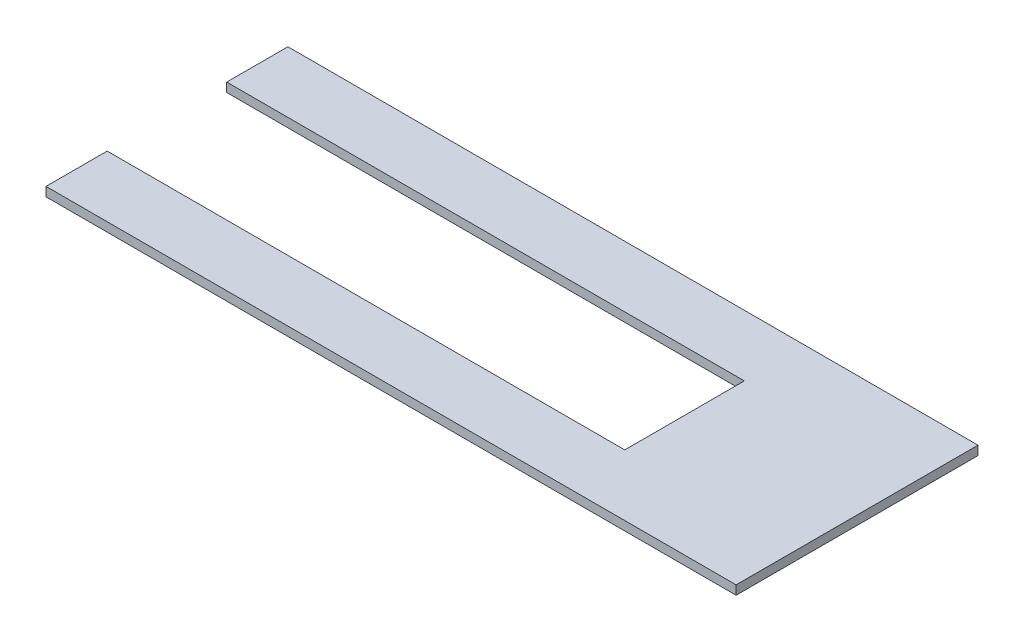
from build123d import *

# Parameters (mm, degrees)
BOSS_EXTRUDE1_DEPTH = 12.7


with BuildPart() as part:
    # Sketch1 → Boss-Extrude1 (new body)
    with BuildSketch(Plane(origin=(0, 0, 0), x_dir=(1, 0, 0), z_dir=(0, 1, 0))):
        Polygon((-485.306758019, 168), (484.693241981, 168), (484.693241981, -172), (-485.306758019, -172), (-485.306758019, -86), (242.193241981, -86), (242.193241981, 82), (-485.306758019, 82), align=None)
    extrude(amount=BOSS_EXTRUDE1_DEPTH)


solid = part.part
